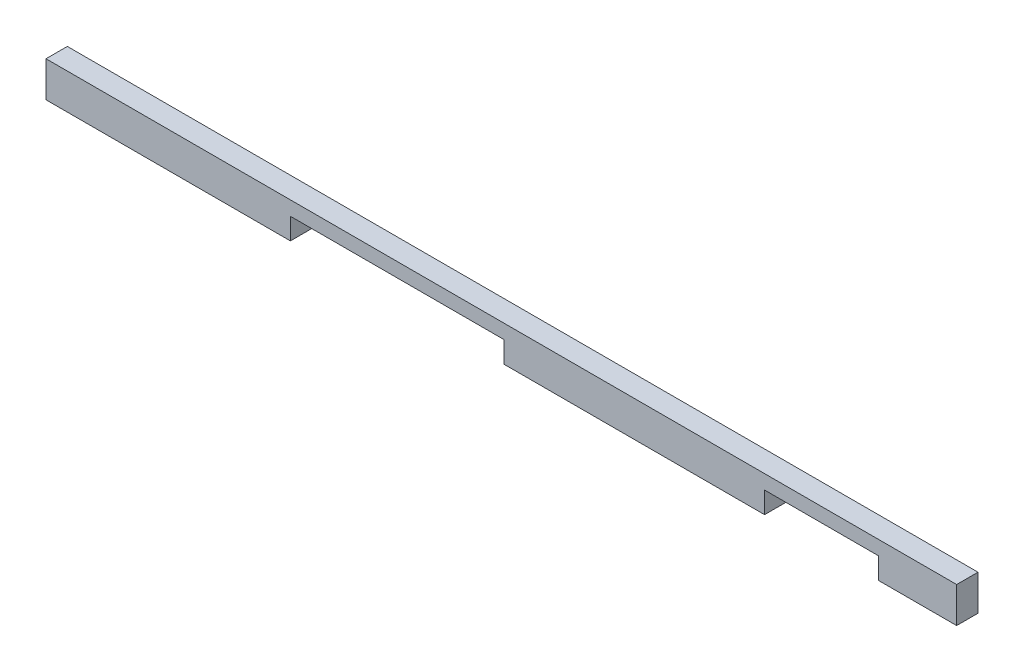
from build123d import *

# Parameters (mm, degrees)
SKETCH1_W           = 812.8
SKETCH1_H           = 19.05
BOSS_EXTRUDE1_DEPTH = 31.75
SKETCH2_W           = 101.6
SKETCH2_H           = 19.05
SKETCH2_W_2         = 190.5
CUT_EXTRUDE1_DEPTH  = 409.083232932


with BuildPart() as part:
    # Sketch1 → Boss-Extrude1 (new body)
    with BuildSketch(Plane(origin=(0, 0, 0), x_dir=(1, 0, 0), z_dir=(0, 1, 0))):
        Rectangle(SKETCH1_W, SKETCH1_H)
    extrude(amount=BOSS_EXTRUDE1_DEPTH)

    # Sketch2 → Cut-Extrude1 (cut, through all)
    with BuildSketch(Plane(origin=(0, 0, -9.525), x_dir=(-1, 0, 0), z_dir=(0, 0, -1))):
        with Locations((-285.75, 9.525)):
            Rectangle(SKETCH2_W, SKETCH2_H)
        with Locations((93.014493473, 9.525)):
            Rectangle(SKETCH2_W_2, SKETCH2_H)
    extrude(amount=-CUT_EXTRUDE1_DEPTH, mode=Mode.SUBTRACT)


solid = part.part
